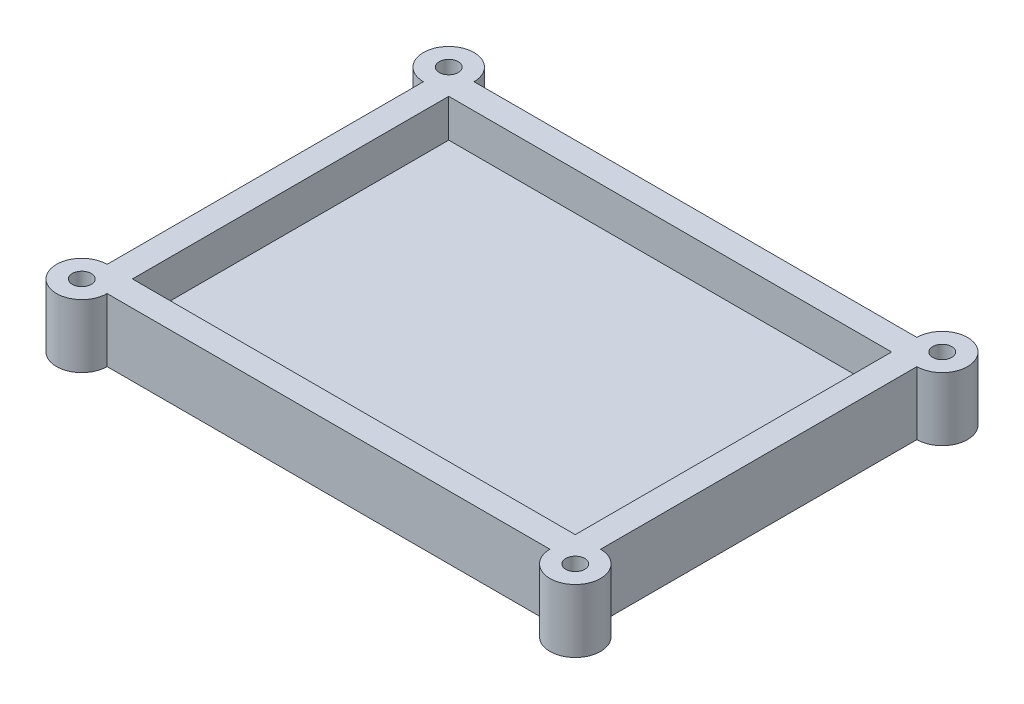
from build123d import *

# Parameters (mm, degrees)
SKETCH2_W                      = 390
SKETCH2_H                      = 290
BOSS_EXTRUDE1_DEPTH            = 50
SHELL1_T                       = -20
SKETCH3_R                      = 20
BOSS_EXTRUDE2_DEPTH            = 50
F_15_0_15_DIAMETER_HOLE1_D     = 15
F_15_0_15_DIAMETER_HOLE1_DEPTH = 20
F_15_0_15_DIAMETER_HOLE1_TIP   = 4.506454643


with BuildPart() as part:
    # Sketch2 → Boss-Extrude1 (new body)
    with BuildSketch(Plane(origin=(0, 0, 0), x_dir=(1, 0, 0), z_dir=(0, 1, 0))):
        Rectangle(SKETCH2_W, SKETCH2_H)
    extrude(amount=BOSS_EXTRUDE1_DEPTH)

    # Shell1
    shell1_openings = [part.faces().sort_by_distance(p)[0] for p in [
        (0, 50, 0),
    ]]
    offset(amount=SHELL1_T, openings=shell1_openings, kind=Kind.INTERSECTION)

    # Sketch3 → Boss-Extrude2 (add)
    with BuildSketch(Plane(origin=(0, 50, 0), x_dir=(1, 0, 0), z_dir=(0, 1, 0))):
        with Locations((-195, 145)):
            Circle(SKETCH3_R)
        with Locations((195, 145)):
            Circle(SKETCH3_R)
        with Locations((195, -145)):
            Circle(SKETCH3_R)
        with Locations((-195, -145)):
            Circle(SKETCH3_R)
    extrude(amount=-BOSS_EXTRUDE2_DEPTH)

    # Ø15.0 (15) Diameter Hole1
    with Locations(Plane(origin=(0, 50, 0), x_dir=(1, 0, 0), z_dir=(0, 1, 0))):
        with Locations((-195, 145), (195, 145), (195, -145), (-195, -145)):
            Hole(F_15_0_15_DIAMETER_HOLE1_D / 2, depth=F_15_0_15_DIAMETER_HOLE1_DEPTH)
            with Locations((0, 0, -(F_15_0_15_DIAMETER_HOLE1_DEPTH + F_15_0_15_DIAMETER_HOLE1_TIP / 2))):  # 118° drill point
                Cone(0, F_15_0_15_DIAMETER_HOLE1_D / 2, F_15_0_15_DIAMETER_HOLE1_TIP, mode=Mode.SUBTRACT)


solid = part.part
